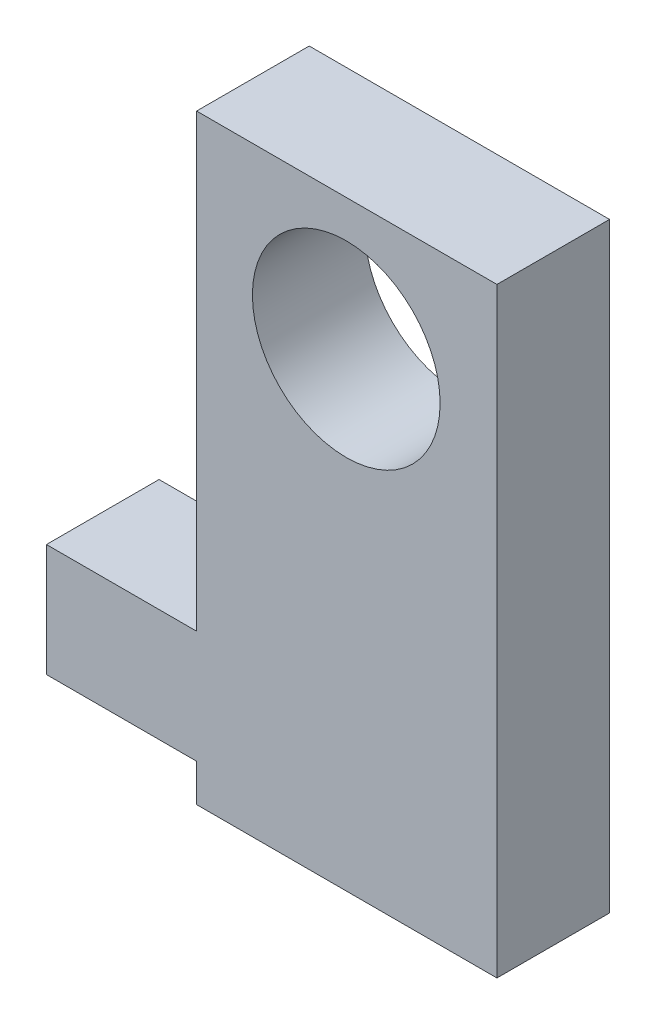
from build123d import *

# Parameters (mm, degrees)
SKETCH1_W           = 8
SKETCH1_H           = 16
BOSS_EXTRUDE1_DEPTH = 3
SKETCH3_R           = 2.5
CUT_EXTRUDE1_DEPTH  = 10
SKETCH2_W           = 3
SKETCH2_H           = 3
BOSS_EXTRUDE3_DEPTH = 4


with BuildPart() as part:
    # Sketch1 → Boss-Extrude1 (new body)
    with BuildSketch(Plane.XY):
        with Locations((4, 8)):
            Rectangle(SKETCH1_W, SKETCH1_H)
    extrude(amount=BOSS_EXTRUDE1_DEPTH)

    # Sketch3 → Cut-Extrude1 (cut)
    with BuildSketch(Plane.XY.offset(3)):
        with Locations((3.98651131, 12.5)):
            Circle(SKETCH3_R)
    extrude(amount=-CUT_EXTRUDE1_DEPTH, mode=Mode.SUBTRACT)

    # Sketch2 → Boss-Extrude3 (add)
    with BuildSketch(Plane.ZY):
        with Locations((1.5, 2.5)):
            Rectangle(SKETCH2_W, SKETCH2_H)
    extrude(amount=BOSS_EXTRUDE3_DEPTH)


solid = part.part
